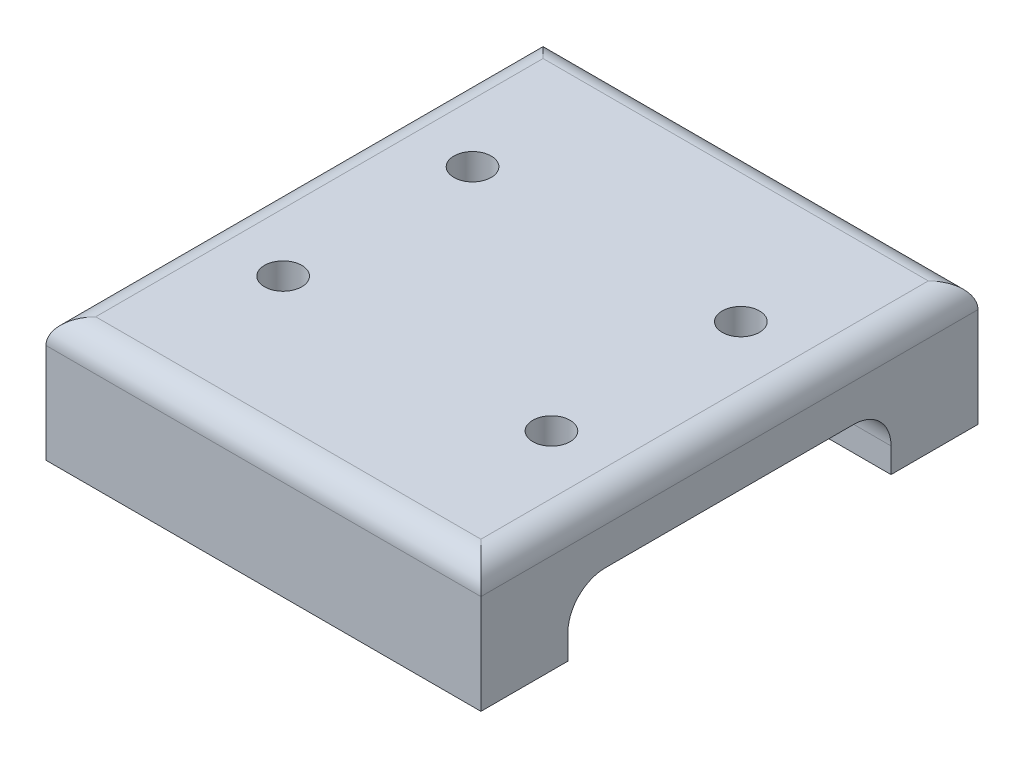
from build123d import *

# Parameters (mm, degrees)
SKETCH1_W            = 35
SKETCH1_H            = 40
BOSS_EXTRUDE1_DEPTH  = 5
SKETCH2_R            = 1.5
CUT_EXTRUDE1_DEPTH   = 5
SKETCH3_W            = 35
SKETCH3_H            = 7
BOSS_EXTRUDE2_DEPTH  = 5
SKETCH5_R            = 2
CUT_EXTRUDE3_DEPTH   = 8.5
FILLET2_R            = 3
FILLET3_R            = 2
FILLET2_OF_MIRROR2_R = 3


with BuildPart() as part:
    # Sketch1 → Boss-Extrude1 (new body)
    with BuildSketch(Plane(origin=(0, 0, 0), x_dir=(1, 0, 0), z_dir=(0, 1, 0))):
        Rectangle(SKETCH1_W, SKETCH1_H)
    extrude(amount=BOSS_EXTRUDE1_DEPTH)

    # Sketch2 → Cut-Extrude1 (cut)
    with BuildSketch(Plane(origin=(0, 5, 0), x_dir=(1, 0, 0), z_dir=(0, 1, 0))):
        with Locations(Location((-10.795, 7.62, 0), (0, 0, 270))):
            Circle(SKETCH2_R)
        with Locations(Location((10.795, 7.62, 0), (0, 0, 270))):
            Circle(SKETCH2_R)
        with Locations(Location((-10.795, -7.62, 0), (0, 0, 270))):
            Circle(SKETCH2_R)
        with Locations(Location((10.795, -7.62, 0), (0, 0, 270))):
            Circle(SKETCH2_R)
    extrude(amount=-CUT_EXTRUDE1_DEPTH, mode=Mode.SUBTRACT)

    # Sketch3 → Boss-Extrude2 (add)
    with BuildSketch(Plane.XZ):
        with Locations((0, 16.5)):
            Rectangle(SKETCH3_W, SKETCH3_H)
    boss_extrude2 = extrude(amount=BOSS_EXTRUDE2_DEPTH)

    # Sketch5 → Cut-Extrude3 (cut)
    with BuildSketch(Plane.XZ.offset(5)):
        with Locations(Location((-10, 16.5, 0), (0, 0, 270))):
            Circle(SKETCH5_R)
        with Locations(Location((10, 16.5, 0), (0, 0, 270))):
            Circle(SKETCH5_R)
    cut_extrude3 = extrude(amount=-CUT_EXTRUDE3_DEPTH, mode=Mode.SUBTRACT)

    # Fillet2
    fillet2_edges = [part.edges().sort_by_distance(p)[0] for p in [
        (0, 0, 13),
    ]]
    fillet(fillet2_edges, radius=FILLET2_R)

    # Fillet3
    fillet3_edges = [part.edges().sort_by_distance(p)[0] for p in [
        (17.5, 5, 0),
        (0, 5, -20),
        (-17.5, 5, 0),
        (0, 5, 20),
    ]]
    fillet(fillet3_edges, radius=FILLET3_R)

    # Mirror2: Boss-Extrude2, Cut-Extrude3 across plane
    add(boss_extrude2.mirror(Plane.XY))
    add(cut_extrude3.mirror(Plane.XY), mode=Mode.SUBTRACT)

    # Fillet2 of Mirror2
    fillet2_of_mirror2_edges = [part.edges().sort_by_distance(p)[0] for p in [
        (0, 0, -13),
    ]]
    fillet(fillet2_of_mirror2_edges, radius=FILLET2_OF_MIRROR2_R)


solid = part.part
